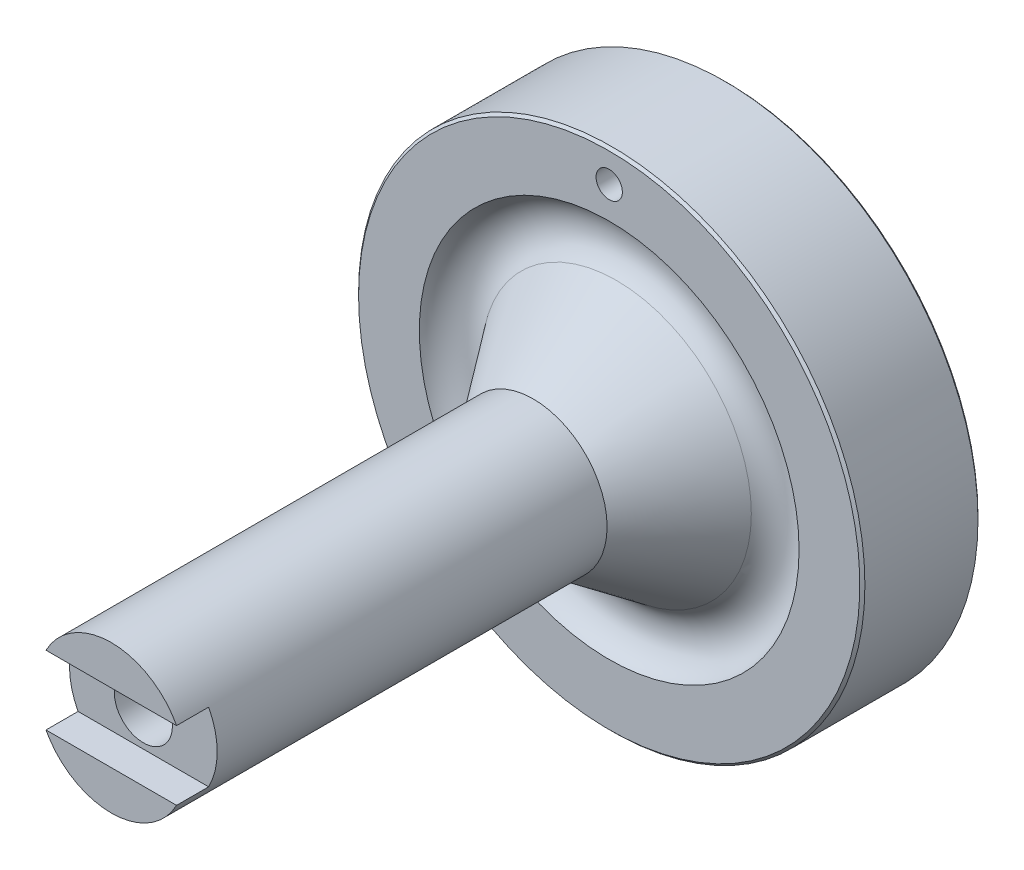
from build123d import *

# Parameters (mm, degrees)
CHAMFER1_SIZE           = 0.762
CUT_EXTRUDE1_DEPTH      = 215.460850507
CUT_EXTRUDE1_DEPTH_BACK = 215.460850507
SKETCH2_W               = 9.652
SKETCH2_H               = 20.7772
SKETCH3_R               = 3.9624
CUT_EXTRUDE2_DEPTH      = 215.460850507


with BuildPart() as part:
    # Sketch1 → Revolve1 (revolve)
    with BuildSketch(Plane(origin=(0, 0, 0), x_dir=(0, 0, -1), z_dir=(1, 0, 0)), mode=Mode.PRIVATE) as revolve1_sk:
        with BuildLine():
            Line((0, 8.7376), (0, 22.225))
            Line((0, 22.225), (127, 22.225))
            Line((127, 22.225), (152.057001163, 40.580938734))
            ThreePointArc((152.057001163, 40.580938734), (155.870445408, 49.516776542), (149.86, 57.15))
            Line((149.86, 57.15), (149.86, 76.2))
            Line((149.86, 76.2), (185.42, 76.2))
            Line((185.42, 76.2), (185.42, 57.15))
            Line((185.42, 57.15), (165.983806543, 42.911680977))
            ThreePointArc((165.983806543, 42.911680977), (162.115628439, 35.956520518), (164.87752482, 28.49267518))
            Line((164.87752482, 28.49267518), (177.4952, 15.875))
            Line((177.4952, 15.875), (177.4952, 8.7376))
            Line((177.4952, 8.7376), (0, 8.7376))
        make_face()
    revolve(revolve1_sk.sketch.rotate(Axis((0, 0, 0), (0, 0, -1)), 90), axis=Axis((0, 0, 0), (0, 0, -1)))

    # Chamfer1
    chamfer1_edges = [part.edges().sort_by_distance(p)[0] for p in [
        (-76.2, 0, -185.42),
        (-76.2, 0, -149.86),
    ]]
    chamfer(chamfer1_edges, length=CHAMFER1_SIZE)

    # Sketch2 → Cut-Extrude1 (cut, two sides: drawn at the far end of the back side and taken through both)
    with BuildSketch(Plane(origin=(0, 0, 0), x_dir=(0, 0, -1), z_dir=(1, 0, 0)).offset(-CUT_EXTRUDE1_DEPTH_BACK)):
        with Locations((4.826, 0)):
            Rectangle(SKETCH2_W, SKETCH2_H)
    extrude(amount=CUT_EXTRUDE1_DEPTH + CUT_EXTRUDE1_DEPTH_BACK, mode=Mode.SUBTRACT)

    # Sketch3 → Cut-Extrude2 (cut, through all)
    with BuildSketch(Plane(origin=(0, 0, -185.42), x_dir=(-1, 0, 0), z_dir=(0, 0, -1))):
        with Locations((0, 66.675)):
            Circle(SKETCH3_R)
    extrude(amount=-CUT_EXTRUDE2_DEPTH, mode=Mode.SUBTRACT)


solid = part.part
